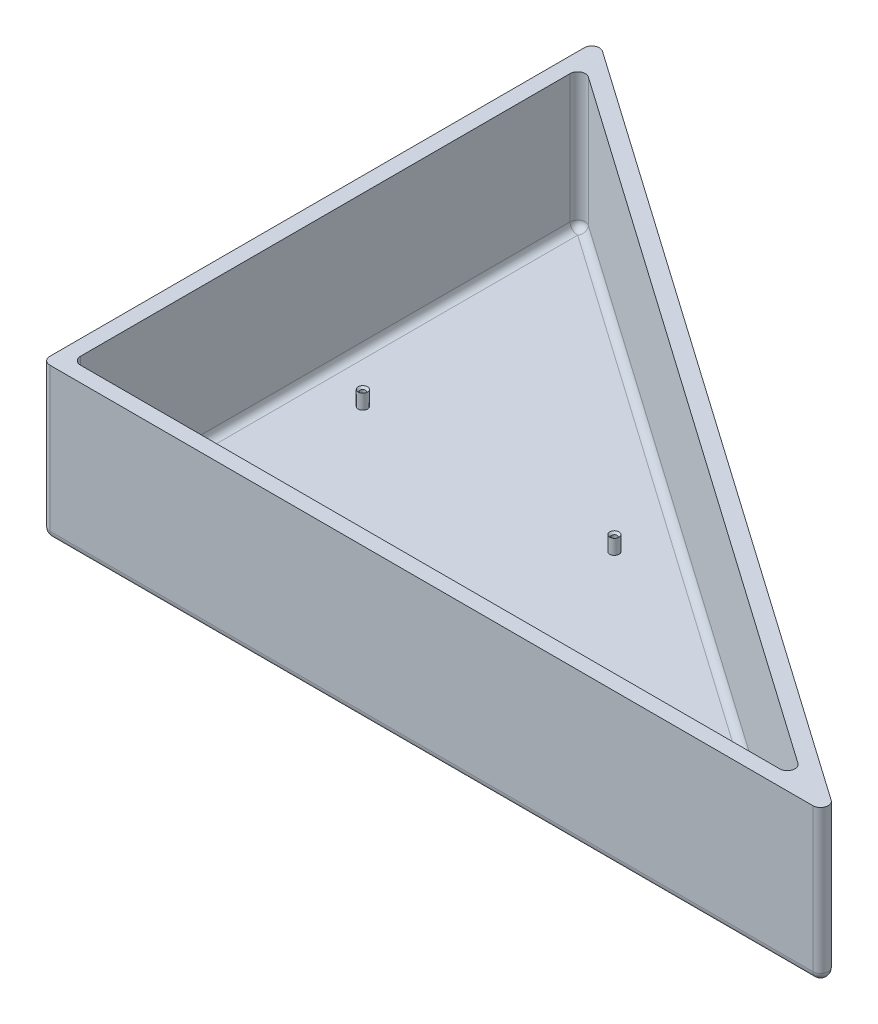
from build123d import *

# Parameters (mm, degrees)
BOSS_EXTRUDE1_DEPTH             = 45.212
BOSS_EXTRUDE2_DEPTH             = 5.08
SKETCH1_4_R                     = 1.5494
BOSS_EXTRUDE3_DEPTH             = 5.08
FILLET1_R                       = 2.54
F_2_56_TAPPED_HOLE1_D           = 1.778
F_2_56_TAPPED_HOLE1_DEPTH       = 5.588
F_2_56_TAPPED_HOLE1_CSINK_D     = 3.4544
F_2_56_TAPPED_HOLE1_CSINK_ANGLE = 90
F_2_56_TAPPED_HOLE1_TIP         = 0.53416509
FILLET3_R                       = 2.54
FILLET4_R                       = 2.54


with BuildPart() as part:
    # Sketch1 → Boss-Extrude1 (new body)
    with BuildSketch(Plane(origin=(0, 0, 0), x_dir=(1, 0, 0), z_dir=(0, 1, 0))):
        Polygon((201.232093857, -52.705), (-62.865, 132.217775938), (-62.865, -52.705), align=None)
        Polygon((-57.785, -47.625), (-57.785, 122.459186733), (185.120392261, -47.625), align=None, mode=Mode.SUBTRACT)
    extrude(amount=BOSS_EXTRUDE1_DEPTH)

    # Sketch1<3> → Boss-Extrude2 (add)
    with BuildSketch(Plane(origin=(0, 0, 0), x_dir=(1, 0, 0), z_dir=(0, 1, 0))):
        Polygon((201.232093857, -52.705), (-62.865, 132.217775938), (-62.865, -52.705), align=None)
    extrude(amount=-BOSS_EXTRUDE2_DEPTH)

    # Sketch1<4> → Boss-Extrude3 (add)
    with BuildSketch(Plane(origin=(0, 0, 0), x_dir=(1, 0, 0), z_dir=(0, 1, 0))):
        with Locations((-41.656, 32.6136)):
            Circle(SKETCH1_4_R)
        with Locations((41.8846, 32.639)):
            Circle(SKETCH1_4_R)
        with Locations((41.7068, -32.3596)):
            Circle(SKETCH1_4_R)
        with Locations((-41.6052, -32.4104)):
            Circle(SKETCH1_4_R)
    extrude(amount=BOSS_EXTRUDE3_DEPTH)

    # Fillet1
    fillet1_edges = [part.edges().sort_by_distance(p)[0] for p in [
        (-62.865, 20.066, -132.217775938),
        (201.232093857, 20.066, 52.705),
        (-62.865, 20.066, 52.705),
        (-57.785, 22.606, 47.625),
        (185.120392261, 22.606, 47.625),
        (-57.785, 22.606, -122.459186733),
    ]]
    fillet(fillet1_edges, radius=FILLET1_R)

    # #2-56 Tapped Hole1
    with Locations(Plane(origin=(0, 5.08, 0), x_dir=(1, 0, 0), z_dir=(0, 1, 0))):
        with Locations((41.8846, 32.639), (-41.656, 32.6136), (41.7068, -32.3596), (-41.656, -32.3596)):
            CounterSinkHole(F_2_56_TAPPED_HOLE1_D / 2, F_2_56_TAPPED_HOLE1_CSINK_D / 2, depth=F_2_56_TAPPED_HOLE1_DEPTH, counter_sink_angle=F_2_56_TAPPED_HOLE1_CSINK_ANGLE)
            with Locations((0, 0, -(F_2_56_TAPPED_HOLE1_DEPTH + F_2_56_TAPPED_HOLE1_TIP / 2))):  # 118° drill point
                Cone(0, F_2_56_TAPPED_HOLE1_D / 2, F_2_56_TAPPED_HOLE1_TIP, mode=Mode.SUBTRACT)

    # Fillet3
    fillet3_edges = [part.edges().sort_by_distance(p)[0] for p in [
        (-61.497841478, -5.08, -129.591488852),
        (195.598684114, -5.08, 50.928792731),
        (-62.121051224, -5.08, 51.961051224),
        (67.882505678, -5.08, -40.66738686),
        (66.425621529, -5.08, 52.705),
        (-62.865, -5.08, -38.586740668),
    ]]
    fillet(fillet3_edges, radius=FILLET3_R)

    # Fillet4
    fillet4_edges = [part.edges().sort_by_distance(p)[0] for p in [
        (179.486982518, 0, 45.848792731),
        (-57.041051224, 0, 46.881051224),
        (-56.417841478, 0, -119.832899647),
        (-57.785, 0, -36.247446065),
        (60.909770731, 0, 47.625),
        (62.36665488, 0, -38.328092258),
    ]]
    fillet(fillet4_edges, radius=FILLET4_R)


solid = part.part
